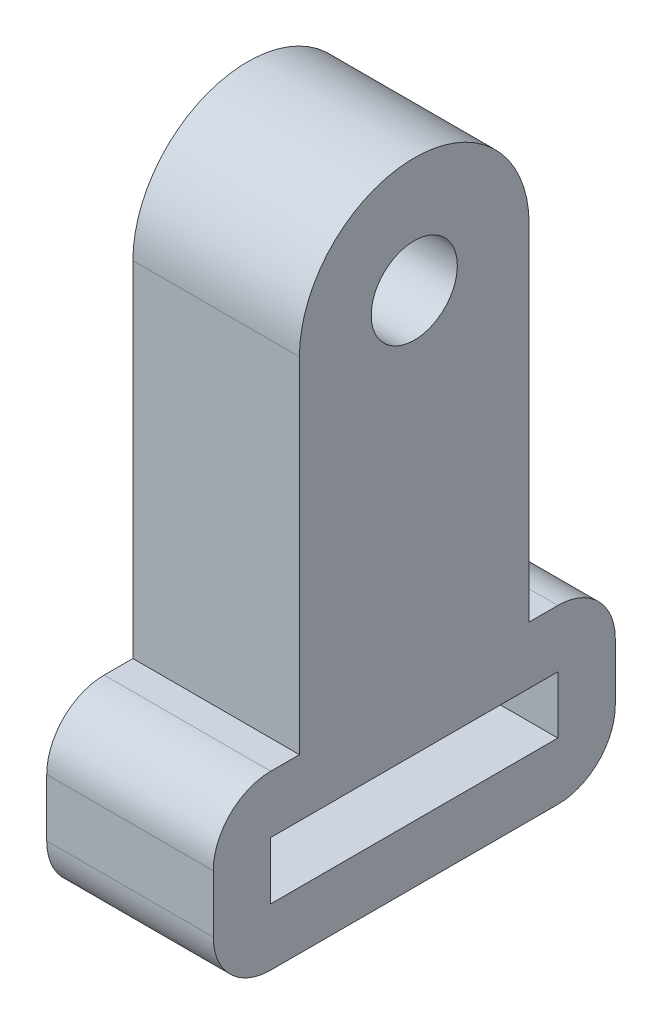
from build123d import *

# Parameters (mm, degrees)
CROQUIS1_R              = 1.5
CROQUIS1_W              = 10
CROQUIS1_H              = 2
SALIENTE_EXTRUIR1_DEPTH = 2.9


with BuildPart() as part:
    # Croquis1 → Saliente-Extruir1 (new, symmetric)
    with BuildSketch(Plane(origin=(0, 0, 0), x_dir=(0, 0, -1), z_dir=(1, 0, 0))):
        with BuildLine():
            Line((-7, 1), (-7, -1))
            ThreePointArc((-7, -1), (-6.414213562, -2.414213562), (-5, -3))
            Line((-5, -3), (5, -3))
            ThreePointArc((5, -3), (6.414213562, -2.414213562), (7, -1))
            Line((7, -1), (7, 1))
            ThreePointArc((7, 1), (6.414213562, 2.414213562), (5, 3))
            Line((5, 3), (4, 3))
            Line((4, 3), (4, 15))
            ThreePointArc((4, 15), (0, 19), (-4, 15))
            Line((-4, 15), (-4, 3))
            Line((-4, 3), (-5, 3))
            ThreePointArc((-5, 3), (-6.414213562, 2.414213562), (-7, 1))
        make_face()
        with Locations((0, 15)):
            Circle(CROQUIS1_R, mode=Mode.SUBTRACT)
        Rectangle(CROQUIS1_W, CROQUIS1_H, mode=Mode.SUBTRACT)
    extrude(amount=SALIENTE_EXTRUIR1_DEPTH, both=True)


solid = part.part
